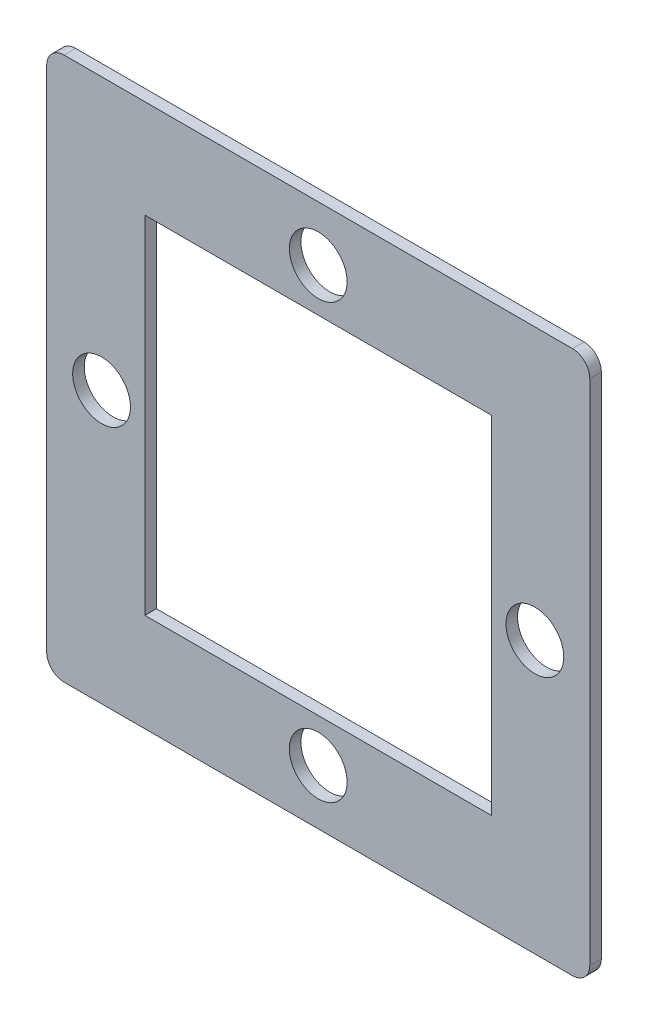
from build123d import *

# Parameters (mm, degrees)
SKETCH1_W           = 47
SKETCH1_H           = 47
SKETCH1_R           = 2.5
SKETCH1_W_2         = 30
SKETCH1_H_2         = 30
BOSS_EXTRUDE1_DEPTH = 1
FILLET1_R           = 1.5


with BuildPart() as part:
    # Sketch1 → Boss-Extrude1 (new body)
    with BuildSketch(Plane.XY):
        with Locations((23.5, 23.5)):
            Rectangle(SKETCH1_W, SKETCH1_H)
        with Locations((23.5, 4.75)):
            Circle(SKETCH1_R, mode=Mode.SUBTRACT)
        with Locations((42.25, 23.5)):
            Circle(SKETCH1_R, mode=Mode.SUBTRACT)
        with Locations((23.5, 42.25)):
            Circle(SKETCH1_R, mode=Mode.SUBTRACT)
        with Locations((4.75, 23.5)):
            Circle(SKETCH1_R, mode=Mode.SUBTRACT)
        with Locations((23.5, 23.5)):
            Rectangle(SKETCH1_W_2, SKETCH1_H_2, mode=Mode.SUBTRACT)
    extrude(amount=BOSS_EXTRUDE1_DEPTH)

    # Fillet1
    fillet1_edges = [part.edges().sort_by_distance(p)[0] for p in [
        (0, 47, 0.5),
        (47, 47, 0.5),
        (47, 0, 0.5),
        (0, 0, 0.5),
    ]]
    fillet(fillet1_edges, radius=FILLET1_R)


solid = part.part
